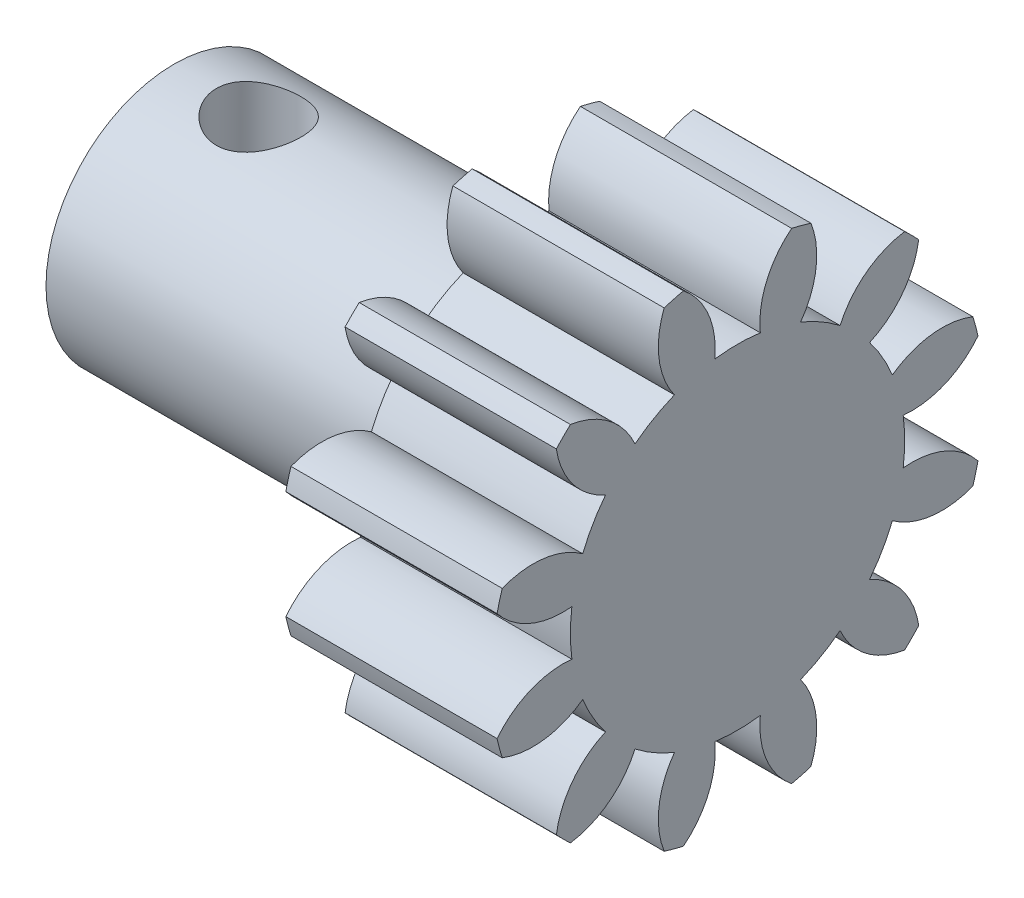
from build123d import *

# Parameters (mm, degrees)
BASPROSKE_W         = 9.525
BASPROSKE_H         = 11.1125
TOOTHCUT_DEPTH      = 19.376641083
TEETHCUTS_COUNT     = 12
TEETHCUTS_ANGLE     = 330
BORSKE_R            = 3.175
BORE_DEPTH          = 50.8000508
BOSS_EXTRUDE1_START = -25.4
SKETCH2_R           = 7.539355
BOSS_EXTRUDE1_DEPTH = 25.4
CUT_EXTRUDE1_DEPTH  = 20
SKETCH5_R           = 1.905
CUT_EXTRUDE2_DEPTH  = 24.605363577
SKETCH6_R           = 12.7
SKETCH6_R_2         = 5.7785
CUT_EXTRUDE3_DEPTH  = 15.875


with BuildPart() as part:
    # BasProSke → Base-Revolve (revolve)
    with BuildSketch(Plane(origin=(0, 0, 0), x_dir=(1, 0, 0), z_dir=(0, 1, 0)), mode=Mode.PRIVATE) as base_revolve_sk:
        with Locations((4.7625, 5.55625)):
            Rectangle(BASPROSKE_W, BASPROSKE_H)
    revolve(base_revolve_sk.sketch.rotate(Axis((-10, 0, 0), (1, 0, 0)), 180), axis=Axis((-10, 0, 0), (1, 0, 0)))

    # TooCutSke → ToothCut (cut, through all)
    with BuildSketch(Plane(origin=(0, 0, 0), x_dir=(0, 0, -1), z_dir=(1, 0, 0))):
        with BuildLine():
            ThreePointArc((1.026937745, 7.469087808), (0, 7.539355), (-1.026937745, 7.469087808))
            ThreePointArc((-1.026937745, 7.469087808), (-1.30857978, 9.35080814), (-2.465050847, 10.861691431))
            ThreePointArc((-2.465050847, 10.861691431), (0, 11.1379), (2.465050847, 10.861691431))
            ThreePointArc((2.465050847, 10.861691431), (1.30857978, 9.35080814), (1.026937745, 7.469087808))
        make_face()
    toothcut = extrude(amount=TOOTHCUT_DEPTH, mode=Mode.SUBTRACT)

    # TeethCuts: ToothCut ×12 about axis
    teethcuts_axis = Axis((-10, 0, 0), (1, 0, 0))
    for i in range(1, TEETHCUTS_COUNT):
        add(toothcut.rotate(teethcuts_axis, i * TEETHCUTS_ANGLE / (TEETHCUTS_COUNT - 1)), mode=Mode.SUBTRACT)

    # BorSke → Bore (cut, symmetric)
    with BuildSketch(Plane(origin=(0, 0, 0), x_dir=(0, 0, -1), z_dir=(1, 0, 0))):
        with Locations(Location((0, 0, 0), (0, 0, 180))):
            Circle(BORSKE_R)
    extrude(amount=BORE_DEPTH, both=True, mode=Mode.SUBTRACT)

    # Sketch2 → Boss-Extrude1 (add)
    with BuildSketch(Plane(origin=(9.525, 0, 0), x_dir=(0, 0, -1), z_dir=(1, 0, 0)).offset(BOSS_EXTRUDE1_START)):
        with Locations(Location((0, 0, 0), (0, 0, 172.171388978))):
            Circle(SKETCH2_R)
    extrude(amount=BOSS_EXTRUDE1_DEPTH)

    # Sketch3 → Cut-Extrude1 (cut)
    with BuildSketch(Plane.ZY.offset(15.875)):
        with BuildLine():
            Line((-1.778, 2.8575), (1.778, 2.8575))
            ThreePointArc((1.778, 2.8575), (0, -3.3655), (-1.778, 2.8575))
        make_face()
    extrude(amount=-CUT_EXTRUDE1_DEPTH, mode=Mode.SUBTRACT)

    # Sketch5 → Cut-Extrude2 (cut, through all)
    with BuildSketch(Plane.XZ.offset(-2.8575)):
        with Locations(Location((-12.065, 0, 0), (0, 0, 270))):
            Circle(SKETCH5_R)
    extrude(amount=-CUT_EXTRUDE2_DEPTH, mode=Mode.SUBTRACT)

    # Sketch6 → Cut-Extrude3 (cut)
    with BuildSketch(Plane.ZY.offset(15.875)):
        Circle(SKETCH6_R)
        Circle(SKETCH6_R_2, mode=Mode.SUBTRACT)
    extrude(amount=-CUT_EXTRUDE3_DEPTH, mode=Mode.SUBTRACT)


solid = part.part
